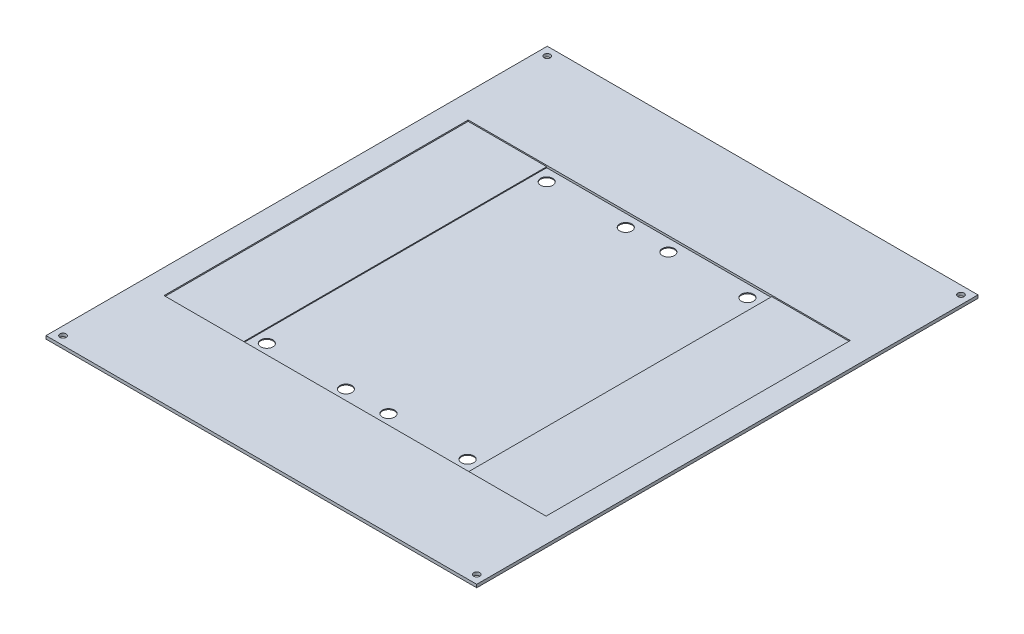
from build123d import *

# Parameters (mm, degrees)
SKETCH1_W                                  = 708
SKETCH1_H                                  = 824
BOSS_EXTRUDE1_DEPTH                        = 5
SKETCH2_W                                  = 370
SKETCH2_H                                  = 500
CUT_EXTRUDE1_DEPTH                         = 3.5
SKETCH3_W                                  = 628
SKETCH3_H                                  = 500
CUT_EXTRUDE2_DEPTH                         = 2
SKETCH11_R                                 = 5.1
CUT_EXTRUDE7_DEPTH                         = 23.2
MIRROR4_AT_THE_SECOND_PLANE_COPY_1_SKETC_R = 5.1
MIRROR4_AT_THE_SECOND_PLANE_COPY_1_DEPTH   = 23.2
SKETCH4_R                                  = 10
CUT_EXTRUDE8_DEPTH                         = 1087.394150389


with BuildPart() as part:
    # Sketch1 → Boss-Extrude1 (new body)
    with BuildSketch(Plane(origin=(0, 0, 0), x_dir=(1, 0, 0), z_dir=(0, 1, 0))):
        with Locations((354, 412)):
            Rectangle(SKETCH1_W, SKETCH1_H)
    extrude(amount=BOSS_EXTRUDE1_DEPTH)

    # Sketch2 → Cut-Extrude1 (cut)
    with BuildSketch(Plane(origin=(0, 5, 0), x_dir=(1, 0, 0), z_dir=(0, 1, 0))):
        with Locations((354, 404)):
            Rectangle(SKETCH2_W, SKETCH2_H)
    extrude(amount=-CUT_EXTRUDE1_DEPTH, mode=Mode.SUBTRACT)

    # Sketch3 → Cut-Extrude2 (cut)
    with BuildSketch(Plane(origin=(0, 5, 0), x_dir=(1, 0, 0), z_dir=(0, 1, 0))):
        with Locations((354, 404)):
            Rectangle(SKETCH3_W, SKETCH3_H)
    extrude(amount=-CUT_EXTRUDE2_DEPTH, mode=Mode.SUBTRACT)

    # Sketch11 → Cut-Extrude7 (cut)
    with BuildSketch(Plane(origin=(0, 5, 0), x_dir=(1, 0, 0), z_dir=(0, 1, 0))):
        with Locations(Location((14, 14, 0), (0, 0, 270))):
            Circle(SKETCH11_R)
    cut_extrude7 = extrude(amount=-CUT_EXTRUDE7_DEPTH, mode=Mode.SUBTRACT)

    # Mirror4: Cut-Extrude7 across plane
    add(cut_extrude7.mirror(Plane(origin=(354, 0, 0), x_dir=(0, 0, 1), z_dir=(1, 0, 0))), mode=Mode.SUBTRACT)

    # Mirror4 at the second plane: Cut-Extrude7 across plane
    add(cut_extrude7.mirror(Plane.XY.offset(-412)), mode=Mode.SUBTRACT)

    # Mirror4 at the second plane copy 1 sketc → Mirror4 at the second plane copy 1 (cut)
    with BuildSketch(Plane(origin=(708, 5, -824), x_dir=(-1, 0, 0), z_dir=(0, 1, 0))):
        with Locations(Location((14, 14, 0), (0, 0, 270))):
            Circle(MIRROR4_AT_THE_SECOND_PLANE_COPY_1_SKETC_R)
    extrude(amount=-MIRROR4_AT_THE_SECOND_PLANE_COPY_1_DEPTH, mode=Mode.SUBTRACT)

    # Sketch4 → Cut-Extrude8 (cut, through all)
    with BuildSketch(Plane(origin=(0, 1.5, 0), x_dir=(1, 0, 0), z_dir=(0, 1, 0))):
        with Locations(Location((189, 634, 0), (0, 0, 270))):
            Circle(SKETCH4_R)
        with Locations(Location((319, 634, 0), (0, 0, 270))):
            Circle(SKETCH4_R)
        with Locations(Location((389, 634, 0), (0, 0, 270))):
            Circle(SKETCH4_R)
        with Locations(Location((519, 634, 0), (0, 0, 270))):
            Circle(SKETCH4_R)
        with Locations(Location((519, 174, 0), (0, 0, 90))):
            Circle(SKETCH4_R)
        with Locations(Location((389, 174, 0), (0, 0, 90))):
            Circle(SKETCH4_R)
        with Locations(Location((319, 174, 0), (0, 0, 90))):
            Circle(SKETCH4_R)
        with Locations(Location((189, 174, 0), (0, 0, 90))):
            Circle(SKETCH4_R)
    extrude(amount=-CUT_EXTRUDE8_DEPTH, mode=Mode.SUBTRACT)


solid = part.part
